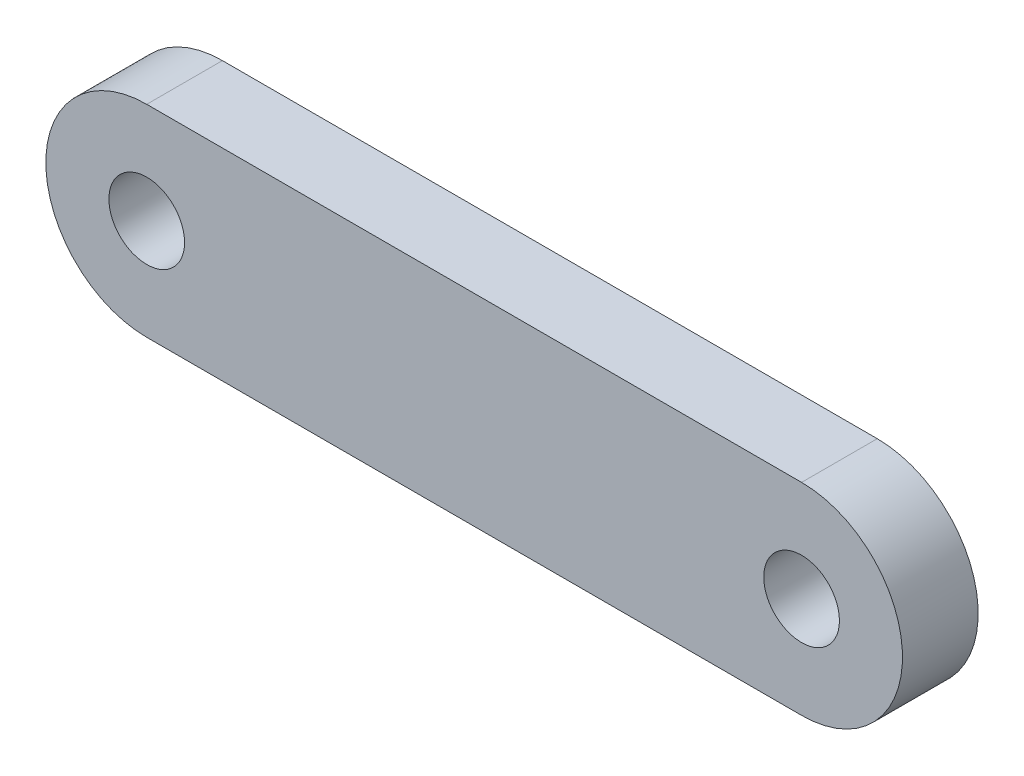
from build123d import *

# Parameters (mm, degrees)
SKETCH1_R           = 1.5
BOSS_EXTRUDE1_DEPTH = 3


with BuildPart() as part:
    # Sketch1 → Boss-Extrude1 (new body)
    with BuildSketch(Plane.XY):
        with BuildLine():
            Line((-25.96, 4), (0, 4))
            ThreePointArc((0, 4), (4, 0), (0, -4))
            Line((0, -4), (-25.96, -4))
            ThreePointArc((-25.96, -4), (-29.96, 0), (-25.96, 4))
        make_face()
        Circle(SKETCH1_R, mode=Mode.SUBTRACT)
        with Locations((-25.96, 0)):
            Circle(SKETCH1_R, mode=Mode.SUBTRACT)
    extrude(amount=BOSS_EXTRUDE1_DEPTH)


solid = part.part
